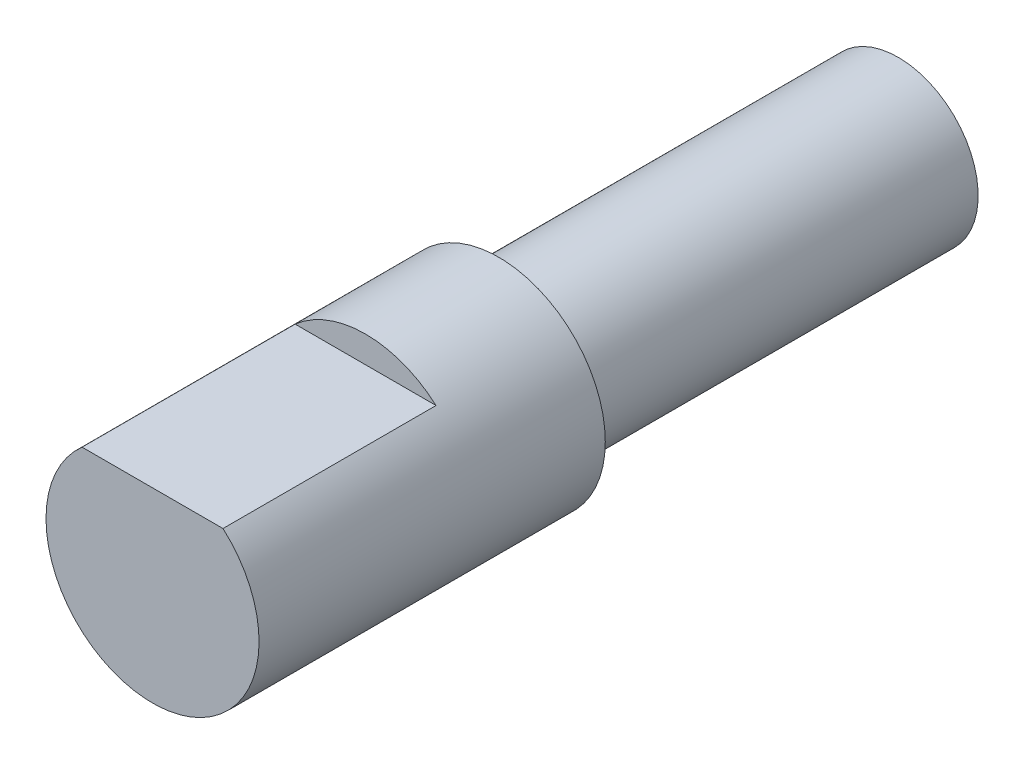
from build123d import *

# Parameters (mm, degrees)
SKETCH_1_R          = 4
EXTRUDE_1_DEPTH     = 28
SKETCH_2_W          = 11.268608601
SKETCH_2_H          = 1.937161227
CUT_EXTRUDE_1_DEPTH = 15
SKETCH_3_W          = 8.764473356
SKETCH_3_H          = 2.433263492
CUT_EXTRUDE_2_DEPTH = 8
SKETCH_4_R          = 4.002706421
CUT_EXTRUDE_3_DEPTH = 15
SKETCH_5_R          = 3
EXTRUDE_2_DEPTH     = 15


with BuildPart() as part:
    # 스케치1 → 보스-돌출1 (new body)
    with BuildSketch(Plane.XY):
        Circle(SKETCH_1_R)
    extrude(amount=EXTRUDE_1_DEPTH)

    # 스케치2 → 컷-돌출1 (cut)
    with BuildSketch(Plane(origin=(0, 0, 0), x_dir=(-1, 0, 0), z_dir=(0, 0, -1))):
        with Locations((0.295298967, 3.968580614)):
            Rectangle(SKETCH_2_W, SKETCH_2_H)
    extrude(amount=-CUT_EXTRUDE_1_DEPTH, mode=Mode.SUBTRACT)

    # 스케치3 → 컷-돌출2 (cut)
    with BuildSketch(Plane.XY.offset(28)):
        with Locations((0.244916085, 4.216631746)):
            Rectangle(SKETCH_3_W, SKETCH_3_H)
    extrude(amount=-CUT_EXTRUDE_2_DEPTH, mode=Mode.SUBTRACT)

    # 스케치4 → 컷-돌출3 (cut)
    with BuildSketch(Plane(origin=(0, 0, 0), x_dir=(-1, 0, 0), z_dir=(0, 0, -1))):
        Circle(SKETCH_4_R)
    extrude(amount=-CUT_EXTRUDE_3_DEPTH, mode=Mode.SUBTRACT)

    # 스케치5 → 보스-돌출2 (add)
    with BuildSketch(Plane(origin=(0, 0, 15), x_dir=(-1, 0, 0), z_dir=(0, 0, -1))):
        Circle(SKETCH_5_R)
    extrude(amount=EXTRUDE_2_DEPTH)


solid = part.part
